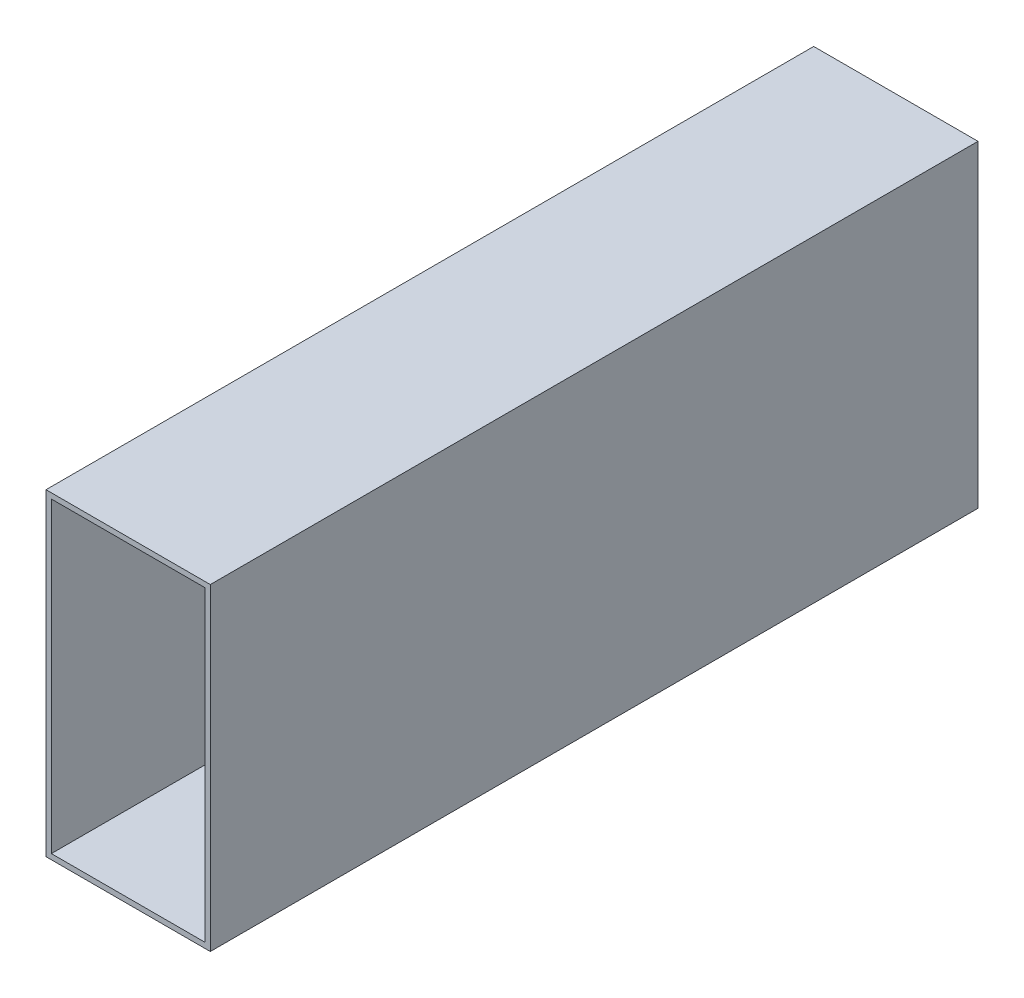
from build123d import *

# Parameters (mm, degrees)
SKETCH1_W           = 27.178
SKETCH1_H           = 52.578
BOSS_EXTRUDE1_DEPTH = 127
SHELL1_T            = -0.889


with BuildPart() as part:
    # Sketch1 → Boss-Extrude1 (new body)
    with BuildSketch(Plane.XY):
        with Locations((13.589, 26.289)):
            Rectangle(SKETCH1_W, SKETCH1_H)
    extrude(amount=BOSS_EXTRUDE1_DEPTH)

    # Shell1
    shell1_openings = [part.faces().sort_by_distance(p)[0] for p in [
        (13.589, 26.289, 127),
        (13.589, 26.289, 0),
    ]]
    offset(amount=SHELL1_T, openings=shell1_openings, kind=Kind.INTERSECTION)


solid = part.part
